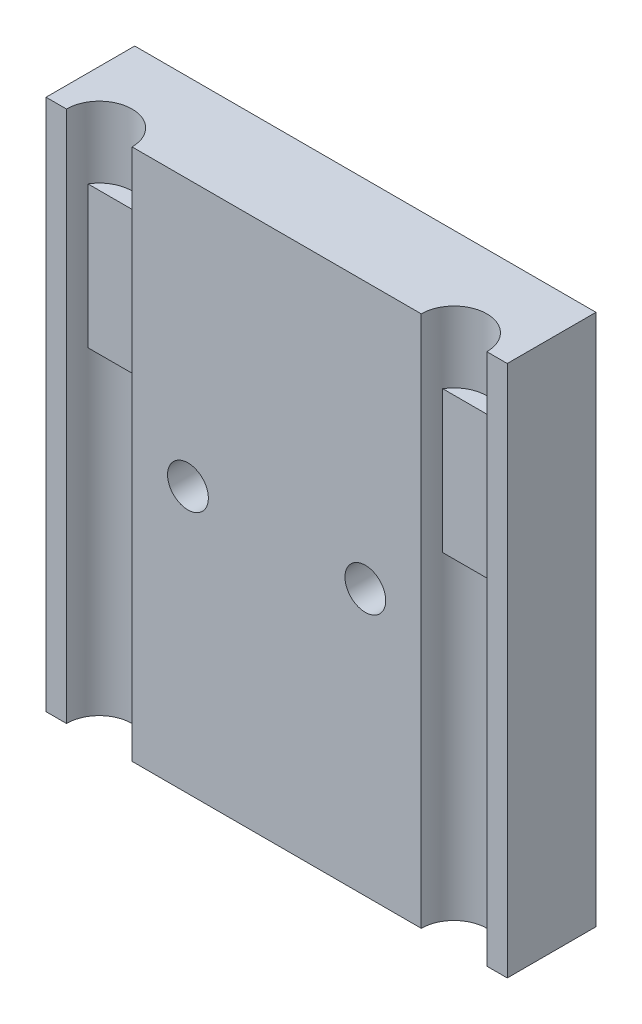
from build123d import *

# Parameters (mm, degrees)
SKETCH_1_W          = 26
SKETCH_1_H          = 30
EXTRUDE_1_DEPTH     = 5
SKETCH_2_R          = 1.85
CUT_EXTRUDE_1_DEPTH = 12
EXTRUDE_START       = 8
EXTRUDE_2_DEPTH     = 8
SKETCH_5_R          = 1.85
CUT_EXTRUDE_2_DEPTH = 33.015621187
SKETCH_6_R          = 1.15
CUT_EXTRUDE_3_DEPTH = 8


with BuildPart() as part:
    # 草图1 → 凸台-拉伸1 (new body)
    with BuildSketch(Plane.XY):
        with Locations((13, -15)):
            Rectangle(SKETCH_1_W, SKETCH_1_H)
    extrude(amount=EXTRUDE_1_DEPTH)

    # 草图2 → 切除-拉伸1 (cut)
    with BuildSketch(Plane(origin=(0, 0, 0), x_dir=(1, 0, 0), z_dir=(0, 1, 0))):
        with Locations((3, -5)):
            Circle(SKETCH_2_R)
        with Locations((23, -5)):
            Circle(SKETCH_2_R)
    extrude(amount=-CUT_EXTRUDE_1_DEPTH, mode=Mode.SUBTRACT)

    # 草图4 → 凸台-拉伸2 (add)
    with BuildSketch(Plane(origin=(0, -12, 0), x_dir=(1, 0, 0), z_dir=(0, 1, 0)).offset(EXTRUDE_START)):
        with BuildLine():
            Line((1.412549213, -4.05), (4.587450787, -4.05))
            ThreePointArc((4.587450787, -4.05), (3, -3.15), (1.412549213, -4.05))
        make_face()
        with BuildLine():
            Line((21.412549213, -4.05), (24.587450787, -4.05))
            ThreePointArc((24.587450787, -4.05), (23, -3.15), (21.412549213, -4.05))
        make_face()
    extrude(amount=-EXTRUDE_2_DEPTH)

    # 草图5 → 切除-拉伸2 (cut, through all)
    with BuildSketch(Plane(origin=(0, -12, 0), x_dir=(1, 0, 0), z_dir=(0, 1, 0))):
        with Locations((3, -5)):
            Circle(SKETCH_5_R)
        with Locations((23, -5)):
            Circle(SKETCH_5_R)
    extrude(amount=-CUT_EXTRUDE_2_DEPTH, mode=Mode.SUBTRACT)

    # 草图6 → 切除-拉伸3 (cut)
    with BuildSketch(Plane(origin=(0, 0, 0), x_dir=(-1, 0, 0), z_dir=(0, 0, -1))):
        with Locations((-18, -15)):
            Circle(SKETCH_6_R)
        with Locations((-8, -15)):
            Circle(SKETCH_6_R)
    extrude(amount=-CUT_EXTRUDE_3_DEPTH, mode=Mode.SUBTRACT)


solid = part.part
